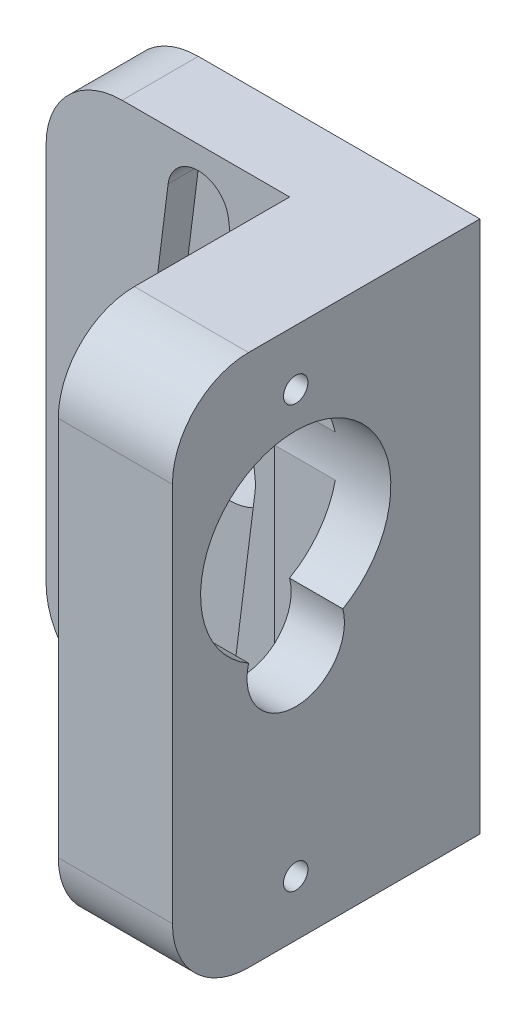
from build123d import *

# Parameters (mm, degrees)
SKETCH1_R                = 3.75
BOSS_EXTRUDE1_DEPTH      = 5
CUT_EXTRUDE2_DEPTH       = 2
BOSS_EXTRUDE2_DEPTH      = 3.5
BOSS_EXTRUDE2_DEPTH_BACK = 4
SKETCH5_R                = 0.8
SKETCH6_W                = 12.2
SKETCH6_H                = 23.2
CUT_EXTRUDE3_DEPTH       = 4


with BuildPart() as part:
    # Sketch1 → Boss-Extrude1 (new body)
    with BuildSketch(Plane.XY):
        with BuildLine():
            Line((10, -17.5), (-5, -17.5))
            ThreePointArc((-5, -17.5), (-8.535533906, -16.035533906), (-10, -12.5))
            Line((-10, -12.5), (-10, 12.5))
            ThreePointArc((-10, 12.5), (-8.535533906, 16.035533906), (-5, 17.5))
            Line((-5, 17.5), (10, 17.5))
            Line((10, 17.5), (10, -17.5))
        make_face()
        Circle(SKETCH1_R, mode=Mode.SUBTRACT)
    extrude(amount=-BOSS_EXTRUDE1_DEPTH)

    # Sketch3 → Cut-Extrude2 (cut)
    with BuildSketch(Plane.XY):
        with BuildLine():
            Line((-1.984313483, 14.25), (-3.720587781, 0.46875))
            ThreePointArc((-3.720587781, 0.46875), (-3.75, 0), (-3.720587781, -0.46875))
            Line((-3.720587781, -0.46875), (-1.984313483, -14.25))
            ThreePointArc((-1.984313483, -14.25), (0, -16), (1.984313483, -14.25))
            Line((1.984313483, -14.25), (3.720587781, -0.46875))
            ThreePointArc((3.720587781, -0.46875), (3.75, 0), (3.720587781, 0.46875))
            Line((3.720587781, 0.46875), (1.984313483, 14.25))
            ThreePointArc((1.984313483, 14.25), (0, 16), (-1.984313483, 14.25))
        make_face()
    extrude(amount=-CUT_EXTRUDE2_DEPTH, mode=Mode.SUBTRACT)

    # Sketch5 → Boss-Extrude2 (add, two sides: drawn at the far end of the back side and taken through both)
    with BuildSketch(Plane(origin=(10, 0, 0), x_dir=(0, 0, -1), z_dir=(1, 0, 0)).offset(-BOSS_EXTRUDE2_DEPTH_BACK)):
        with BuildLine():
            Line((5, 17.5), (-10.2, 17.5))
            ThreePointArc((-10.2, 17.5), (-13.735533906, 16.035533906), (-15.2, 12.5))
            Line((-15.2, 12.5), (-15.2, -12.5))
            ThreePointArc((-15.2, -12.5), (-13.735533906, -16.035533906), (-10.2, -17.5))
            Line((-10.2, -17.5), (5, -17.5))
            Line((5, -17.5), (5, 17.5))
        make_face()
        with Locations((-7.1, 13.85)):
            Circle(SKETCH5_R, mode=Mode.SUBTRACT)
        with Locations((-7.1, -13.85)):
            Circle(SKETCH5_R, mode=Mode.SUBTRACT)
        with BuildLine():
            ThreePointArc((-4.006634299, -0.1808), (-7.1, 11.5), (-10.193365701, -0.1808))
            ThreePointArc((-10.193365701, -0.1808), (-7.1, -4.2), (-4.006634299, -0.1808))
        make_face(mode=Mode.SUBTRACT)
    extrude(amount=BOSS_EXTRUDE2_DEPTH + BOSS_EXTRUDE2_DEPTH_BACK)

    # Sketch6 → Cut-Extrude3 (cut)
    with BuildSketch(Plane.ZY.offset(-6)):
        with Locations((7.1, 0)):
            Rectangle(SKETCH6_W, SKETCH6_H)
    extrude(amount=-CUT_EXTRUDE3_DEPTH, mode=Mode.SUBTRACT)


solid = part.part
